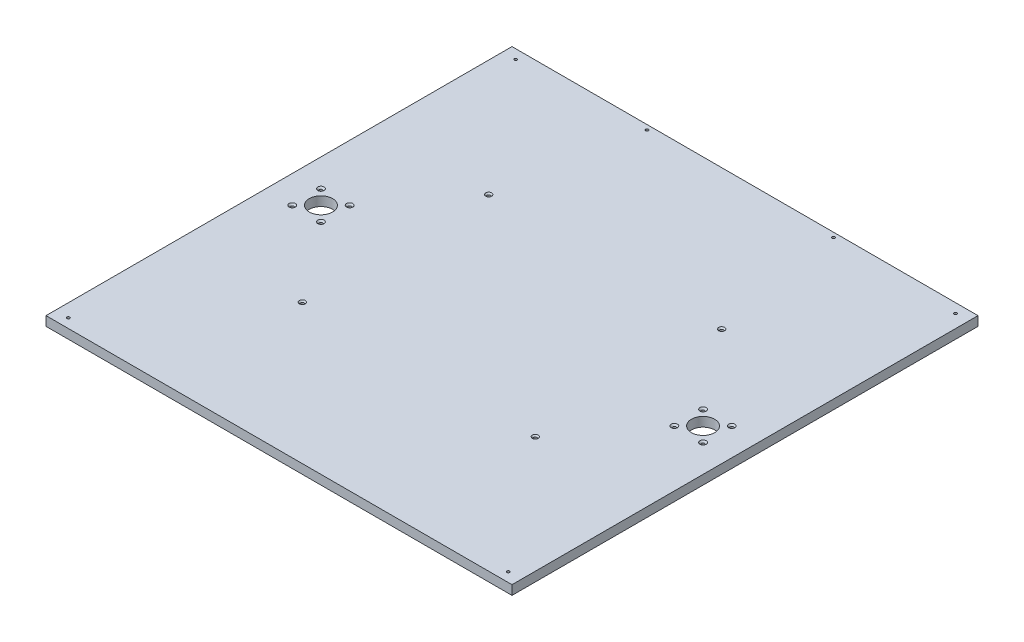
from build123d import *

# Parameters (mm, degrees)
SZKIC1_W                                             = 500
SZKIC1_H                                             = 500
DODANIE_WYCI_GNI_CIE1_DEPTH                          = 10
SZKIC2_R                                             = 12.5
WYTNIJ_WYCI_GNI_CIE1_DEPTH                           = 708.177488329
POG_BIENIE_STO_KOWE_POD_M3_WKR_T_USTALAJ_D           = 3.4
POG_BIENIE_STO_KOWE_POD_M3_WKR_T_USTALAJ_CSINK_D     = 6.72
POG_BIENIE_STO_KOWE_POD_M3_WKR_T_USTALAJ_CSINK_ANGLE = 90
POG_BIENIE_STO_KOWE_POD_M3_WKR_T_DO_CZ_C_D           = 3.4
POG_BIENIE_STO_KOWE_POD_M3_WKR_T_DO_CZ_C_DEPTH       = 10
POG_BIENIE_STO_KOWE_POD_M3_WKR_T_DO_CZ_C_CSINK_D     = 6.3
POG_BIENIE_STO_KOWE_POD_M3_WKR_T_DO_CZ_C_CSINK_ANGLE = 90
POG_BIENIE_STO_KOWE_POD_M3_WKR_T_DO_CZ_C_TIP         = 1.021463052
OTWORY_USTALAJ_CE_3_0MM1_D                           = 3
OTWORY_USTALAJ_CE_3_0MM1_DEPTH                       = 10
OTWORY_USTALAJ_CE_3_0MM1_TIP                         = 0.901290929
OTWORY_USTALAJ_CE_3_0MM2_D                           = 3
OTWORY_USTALAJ_CE_3_0MM2_DEPTH                       = 10
OTWORY_USTALAJ_CE_3_0MM2_TIP                         = 0.901290929


with BuildPart() as part:
    # Szkic1 → Dodanie-wyciągnięcie1 (new body)
    with BuildSketch(Plane(origin=(0, 0, 0), x_dir=(1, 0, 0), z_dir=(0, 1, 0))):
        with Locations((250, 250)):
            Rectangle(SZKIC1_W, SZKIC1_H)
    extrude(amount=DODANIE_WYCI_GNI_CIE1_DEPTH)

    # Szkic2 → Wytnij-wyciągnięcie1 (cut, through all)
    with BuildSketch(Plane(origin=(0, 10, 0), x_dir=(1, 0, 0), z_dir=(0, 1, 0))):
        with Locations(Location((45, 250, 0), (0, 0, 270))):
            Circle(SZKIC2_R)
        with Locations(Location((455, 250, 0), (0, 0, 270))):
            Circle(SZKIC2_R)
    extrude(amount=-WYTNIJ_WYCI_GNI_CIE1_DEPTH, mode=Mode.SUBTRACT)

    # Pogłębienie stożkowe pod M3 Wkręt ustalający1 (through all)
    with Locations(Plane(origin=(0, 10, 0), x_dir=(1, 0, 0), z_dir=(0, 1, 0))):
        with Locations((439.6, 265.4), (439.6, 234.6), (470.4, 234.6), (470.4, 265.4), (60.4, 234.6), (60.4, 265.4), (29.6, 234.6), (29.6, 265.4)):
            CounterSinkHole(POG_BIENIE_STO_KOWE_POD_M3_WKR_T_USTALAJ_D / 2, POG_BIENIE_STO_KOWE_POD_M3_WKR_T_USTALAJ_CSINK_D / 2, counter_sink_angle=POG_BIENIE_STO_KOWE_POD_M3_WKR_T_USTALAJ_CSINK_ANGLE)

    # Pogłębienie stożkowe pod M3 wkręt do części metalowych z łbem soczewkowym1
    with Locations(Plane(origin=(0, 10, 0), x_dir=(1, 0, 0), z_dir=(0, 1, 0))):
        with Locations((375, 350), (375, 150), (125, 350), (125, 150)):
            CounterSinkHole(POG_BIENIE_STO_KOWE_POD_M3_WKR_T_DO_CZ_C_D / 2, POG_BIENIE_STO_KOWE_POD_M3_WKR_T_DO_CZ_C_CSINK_D / 2, depth=POG_BIENIE_STO_KOWE_POD_M3_WKR_T_DO_CZ_C_DEPTH, counter_sink_angle=POG_BIENIE_STO_KOWE_POD_M3_WKR_T_DO_CZ_C_CSINK_ANGLE)
            with Locations((0, 0, -(POG_BIENIE_STO_KOWE_POD_M3_WKR_T_DO_CZ_C_DEPTH + POG_BIENIE_STO_KOWE_POD_M3_WKR_T_DO_CZ_C_TIP / 2))):  # 118° drill point
                Cone(0, POG_BIENIE_STO_KOWE_POD_M3_WKR_T_DO_CZ_C_D / 2, POG_BIENIE_STO_KOWE_POD_M3_WKR_T_DO_CZ_C_TIP, mode=Mode.SUBTRACT)

    # Otwory ustalające Ø3.0mm1
    with Locations(Plane(origin=(0, 0, 0), x_dir=(-1, 0, 0), z_dir=(0, -1, 0))):
        with Locations((-486, 490), (-486, 10), (-14, 10), (-14, 490)):
            Hole(OTWORY_USTALAJ_CE_3_0MM1_D / 2, depth=OTWORY_USTALAJ_CE_3_0MM1_DEPTH)
            with Locations((0, 0, -(OTWORY_USTALAJ_CE_3_0MM1_DEPTH + OTWORY_USTALAJ_CE_3_0MM1_TIP / 2))):  # 118° drill point
                Cone(0, OTWORY_USTALAJ_CE_3_0MM1_D / 2, OTWORY_USTALAJ_CE_3_0MM1_TIP, mode=Mode.SUBTRACT)

    # Otwory ustalające Ø3.0mm2
    with Locations(Plane(origin=(0, 0, 0), x_dir=(-1, 0, 0), z_dir=(0, -1, 0))):
        with Locations((-150, 495), (-350, 495)):
            Hole(OTWORY_USTALAJ_CE_3_0MM2_D / 2, depth=OTWORY_USTALAJ_CE_3_0MM2_DEPTH)
            with Locations((0, 0, -(OTWORY_USTALAJ_CE_3_0MM2_DEPTH + OTWORY_USTALAJ_CE_3_0MM2_TIP / 2))):  # 118° drill point
                Cone(0, OTWORY_USTALAJ_CE_3_0MM2_D / 2, OTWORY_USTALAJ_CE_3_0MM2_TIP, mode=Mode.SUBTRACT)


solid = part.part
